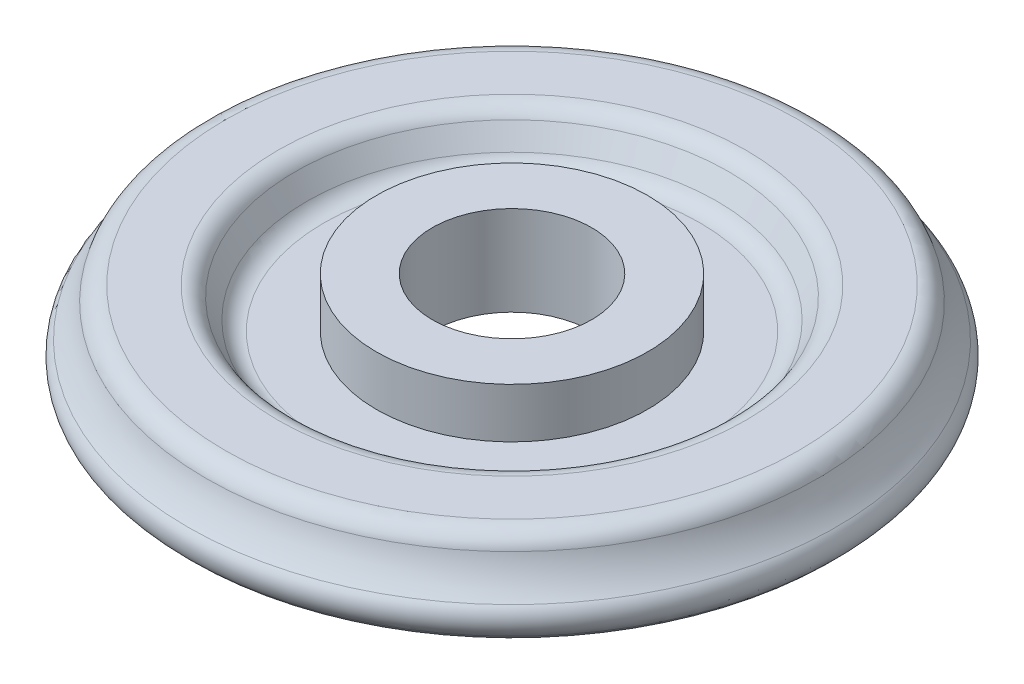
from build123d import *

# Parameters (mm, degrees)
FILLET1_R        = 1.5875
SKETCH2_R        = 10.795
ROUND_BOSS_DEPTH = 3.96875
SKETCH4_R        = 6.35
HOLE_DEPTH       = 6.35
MODULAR_REACH    = 39.644
SKETCH12_R       = 6.35


with BuildPart() as part:
    # Sketch1 → Base-Revolve (revolve)
    with BuildSketch(Plane.XY, mode=Mode.PRIVATE) as base_revolve_sk:
        with BuildLine():
            Line((0, 0), (25.4, 0))
            Line((25.4, 0), (26.9875, 1.5875))
            ThreePointArc((26.9875, 1.5875), (25.010459227, 3.639775536), (24.13, 6.35))
            Line((24.13, 6.35), (17.708087105, 6.35))
            Line((17.708087105, 6.35), (15.875, 3.175))
            Line((15.875, 3.175), (0, 3.175))
            Line((0, 3.175), (0, 0))
        make_face()
    revolve(base_revolve_sk.sketch.rotate(Axis((0, 4.772511252, 0), (0, -1, 0)), 90), axis=Axis((0, 4.772511252, 0), (0, -1, 0)))

    # Fillet1
    fillet1_edges = [part.edges().sort_by_distance(p)[0] for p in [
        (0, 3.175, -15.875),
        (0, 6.35, -17.708087105),
        (0, 6.35, -24.13),
        (0, 1.5875, -26.9875),
    ]]
    fillet(fillet1_edges, radius=FILLET1_R)

    # Sketch2 → Round Boss (add)
    with BuildSketch(Plane(origin=(0, 3.175, 0), x_dir=(-1, 0, 0), z_dir=(0, 1, 0))):
        with Locations(Location((0, 0, 0), (0, 0, 270))):
            Circle(SKETCH2_R)
    extrude(amount=ROUND_BOSS_DEPTH)

    # Sketch4 → hole (cut)
    with BuildSketch(Plane(origin=(0, 0, 0), x_dir=(-1, 0, 0), z_dir=(0, 1, 0))):
        with Locations(Location((0, 0, 0), (0, 0, 90))):
            Circle(SKETCH4_R)
    extrude(amount=HOLE_DEPTH, mode=Mode.SUBTRACT)

    # Sketch12 → Modular (cut, up to next)
    with BuildSketch(Plane(origin=(0, 6.35, 0), x_dir=(-1, 0, 0), z_dir=(0, 1, 0)), mode=Mode.PRIVATE) as modular_sk1:
        with Locations(Location((0, 0, 0), (0, 0, 90))):
            Circle(SKETCH12_R)
    modular_tool1 = extrude(modular_sk1.sketch, amount=MODULAR_REACH, mode=Mode.PRIVATE) & part.part
    add(modular_tool1.solids().sort_by_distance((0, 6.35, 0))[0], mode=Mode.SUBTRACT)


solid = part.part
